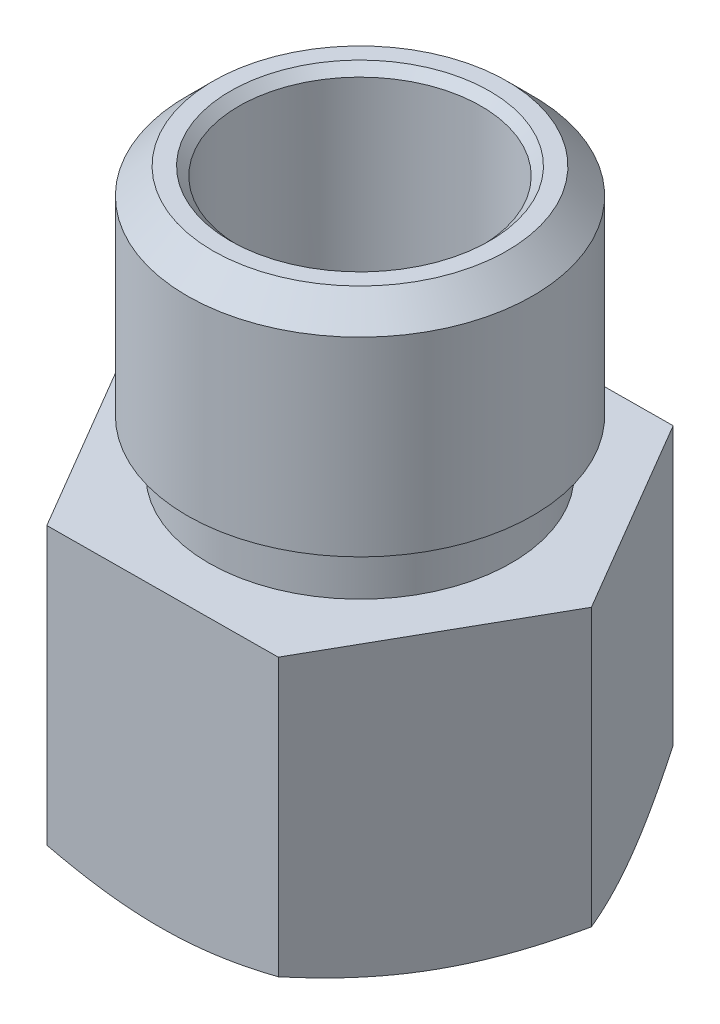
from build123d import *

# Parameters (mm, degrees)
EXTRUDE_1_DEPTH     = 17
SKETCH_2_R          = 8.75
EXTRUDE_2_DEPTH     = 3
SKETCH_3_R          = 10
EXTRUDE_3_DEPTH     = 12.5
CHAMFER_1_SIZE      = 1.5
SKETCH_6_R          = 7
CUT_EXTRUDE_1_DEPTH = 37.958912269
CHAMFER_2_SIZE      = 0.5
SKETCH_7_R          = 9.5
CUT_EXTRUDE_2_DEPTH = 13


with BuildPart() as part:
    # 草图1 → 凸台-拉伸1 (new body)
    with BuildSketch(Plane(origin=(0, 0, 0), x_dir=(1, 0, 0), z_dir=(0, 1, 0))):
        Polygon((6.553289027, 11.549360859), (-6.725395388, 11.449995205), (-13.278684415, -0.099365654), (-6.553289027, -11.549360859), (6.725395388, -11.449995205), (13.278684415, 0.099365654), align=None)
    extrude(amount=EXTRUDE_1_DEPTH)

    # 草图2 → 凸台-拉伸2 (add)
    with BuildSketch(Plane(origin=(0, 17, 0), x_dir=(1, 0, 0), z_dir=(0, 1, 0))):
        with Locations(Location((0, 0, 0), (0, 0, 270))):
            Circle(SKETCH_2_R)
    extrude(amount=EXTRUDE_2_DEPTH)

    # 草图3 → 凸台-拉伸3 (add)
    with BuildSketch(Plane(origin=(0, 20, 0), x_dir=(1, 0, 0), z_dir=(0, 1, 0))):
        with Locations(Location((0, 0, 0), (0, 0, 270))):
            Circle(SKETCH_3_R)
    extrude(amount=EXTRUDE_3_DEPTH)

    # 倒角1
    chamfer_1_edges = [part.edges().sort_by_distance(p)[0] for p in [
        (0, 32.5, -10),
    ]]
    chamfer(chamfer_1_edges, length=CHAMFER_1_SIZE)

    # 草图5 → 切除-旋转3 (revolve, cut)
    with BuildSketch(Plane(origin=(0, 0, 0), x_dir=(0.49350563267132574, 0, -0.8697426001534446), z_dir=(0.8697426001534445, 0, 0.4935056326713257)), mode=Mode.PRIVATE) as cut_revolve_3_sk:
        Polygon((13.279056191, 1), (11.279056191, 0), (13.279056191, 0), align=None)
    revolve(cut_revolve_3_sk.sketch.rotate(Axis((0, -1000, 0), (0, 1, 0)), 180.000000003), axis=Axis((0, -1000, 0), (0, 1, 0)), mode=Mode.SUBTRACT)

    # 草图6 → 切除-拉伸1 (cut, through all)
    with BuildSketch(Plane(origin=(0, 32.5, 0), x_dir=(1, 0, 0), z_dir=(0, 1, 0))):
        with Locations(Location((0, 0, 0), (0, 0, 270))):
            Circle(SKETCH_6_R)
    extrude(amount=-CUT_EXTRUDE_1_DEPTH, mode=Mode.SUBTRACT)

    # 倒角2
    chamfer_2_edges = [part.edges().sort_by_distance(p)[0] for p in [
        (0, 0, -7),
        (0, 32.5, -7),
    ]]
    chamfer(chamfer_2_edges, length=CHAMFER_2_SIZE)

    # 草图7 → 切除-拉伸2 (cut)
    with BuildSketch(Plane.XZ):
        with Locations(Location((0, 0, 0), (0, 0, 270))):
            Circle(SKETCH_7_R)
    extrude(amount=-CUT_EXTRUDE_2_DEPTH, mode=Mode.SUBTRACT)


solid = part.part
